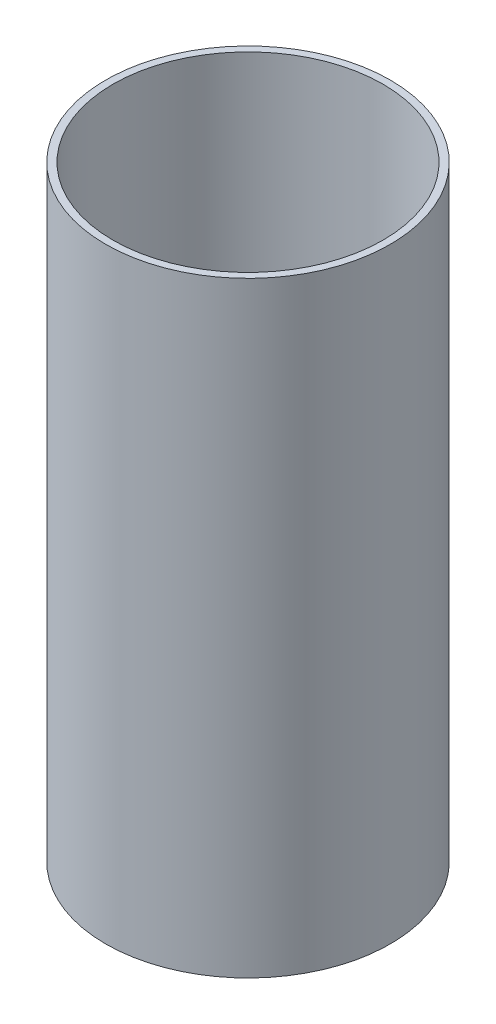
from build123d import *

# Parameters (mm, degrees)
SKETCH1_R           = 93.6625
SKETCH1_R_2         = 88.9
BOSS_EXTRUDE1_DEPTH = 199.39


with BuildPart() as part:
    # Sketch1 → Boss-Extrude1 (new, symmetric)
    with BuildSketch(Plane(origin=(0, 0, 0), x_dir=(1, 0, 0), z_dir=(0, 1, 0))):
        with Locations(Location((0, 0, 0), (0, 0, 270))):
            Circle(SKETCH1_R)
        with Locations(Location((0, 0, 0), (0, 0, 270))):
            Circle(SKETCH1_R_2, mode=Mode.SUBTRACT)
    extrude(amount=BOSS_EXTRUDE1_DEPTH, both=True)


solid = part.part
